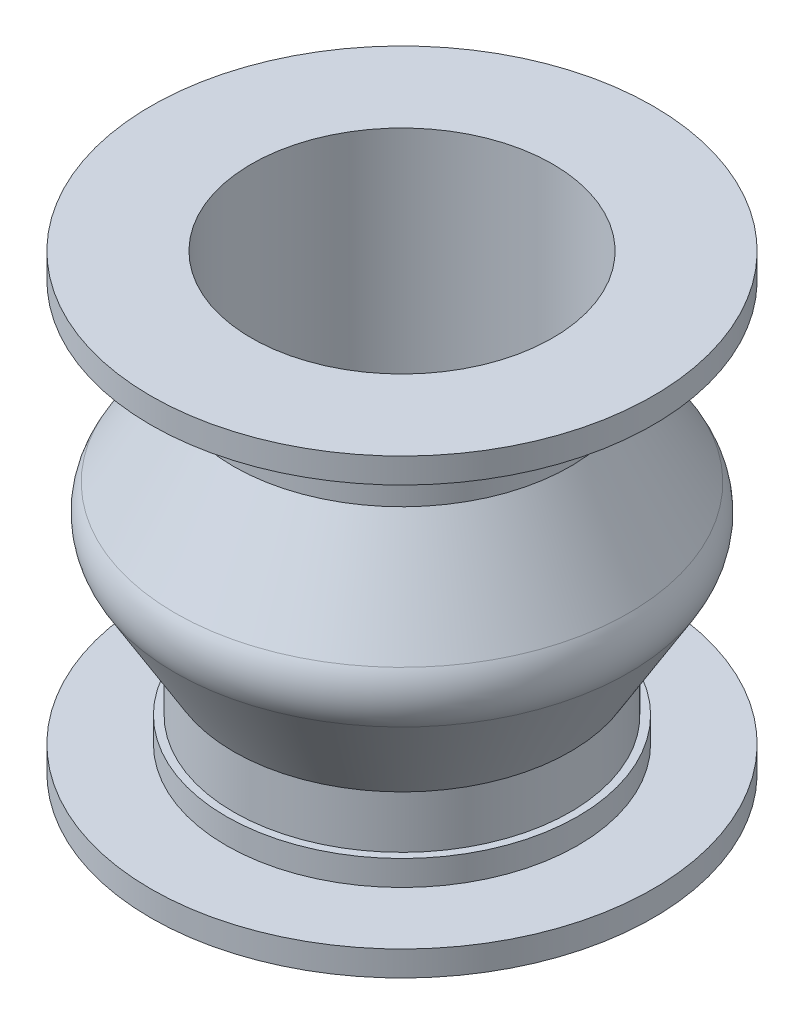
from build123d import *

# Parameters (mm, degrees)
BOSS_EXTRUDE1_DEPTH = 5
SKETCH4_R           = 30
CUT_EXTRUDE1_DEPTH  = 115.455231423


with BuildPart() as part:
    # Sketch1 → Revolve1 (revolve)
    with BuildSketch(Plane.XY, mode=Mode.PRIVATE) as revolve1_sk:
        with BuildLine():
            Line((0, 45), (-50, 45))
            Line((-50, 45), (-50, 40))
            Line((-50, 40), (-35, 40))
            Line((-35, 40), (-35, 35))
            Line((-35, 35), (-33.5, 35))
            Line((-33.5, 35), (-33.5, 24.584524053))
            Line((-33.5, 24.584524053), (-45.163739899, 5.144957554))
            ThreePointArc((-45.163739899, 5.144957554), (-46.588810642, 0), (-45.163739899, -5.144957554))
            Line((-45.163739899, -5.144957554), (-33.5, -24.584524053))
            Line((-33.5, -24.584524053), (-33.5, -35))
            Line((-33.5, -35), (-35, -35))
            Line((-35, -35), (-35, -40))
            Line((-35, -40), (-50, -40))
            Line((-50, -40), (-50, -45))
            Line((-50, -45), (0, -45))
            Line((0, -45), (0, 45))
        make_face()
    revolve(revolve1_sk.sketch.rotate(Axis((0, 78.93258427, 0), (0, -1, 0)), 270), axis=Axis((0, 78.93258427, 0), (0, -1, 0)))

    # Sketch2 → Boss-Extrude1 (add)
    with BuildSketch(Plane(origin=(0, 35, 0), x_dir=(1, 0, 0), z_dir=(0, 1, 0))):
        with BuildLine():
            Line((-5, 36.66060556), (-5, 34.641016151))
            ThreePointArc((-5, 34.641016151), (0, 35), (5, 34.641016151))
            Line((5, 34.641016151), (5, 36.66060556))
            ThreePointArc((5, 36.66060556), (0, 37), (-5, 36.66060556))
        make_face()
    extrude(amount=BOSS_EXTRUDE1_DEPTH)

    # Sketch4 → Cut-Extrude1 (cut, through all)
    with BuildSketch(Plane.XZ.offset(45)):
        with Locations(Location((0, 0, 0), (0, 0, 270))):
            Circle(SKETCH4_R)
    extrude(amount=-CUT_EXTRUDE1_DEPTH, mode=Mode.SUBTRACT)


solid = part.part
